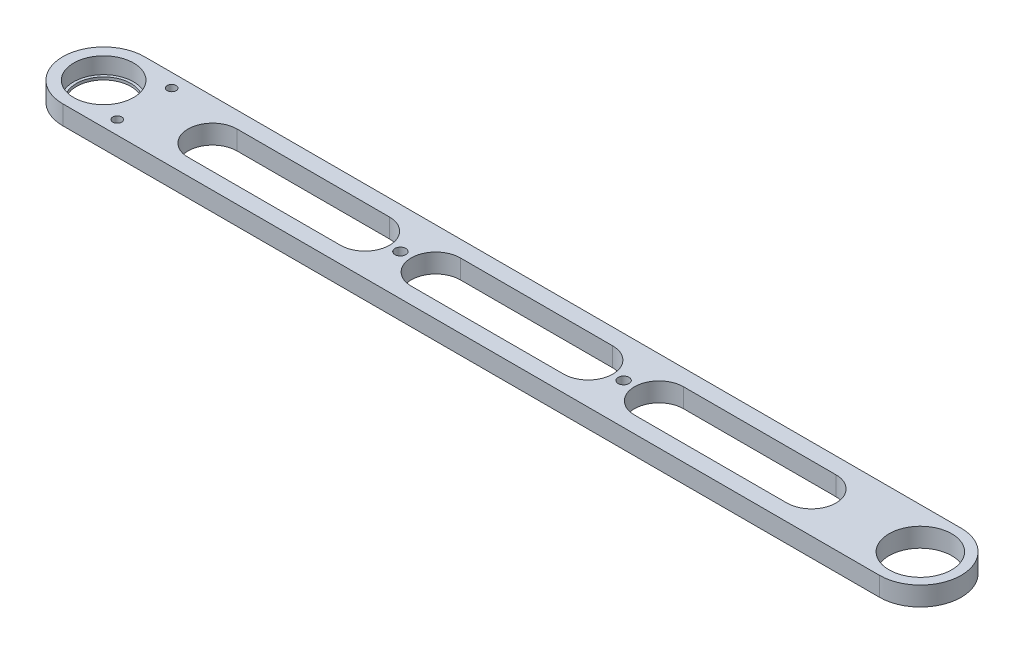
from build123d import *

# Parameters (mm, degrees)
SKETCH1_R             = 11.5
SKETCH1_R_2           = 10
SKETCH1_R_3           = 2
BOSS_EXTRUDE1_DEPTH   = 7
SKETCH2_R             = 11
CUT_EXTRUDE1_DEPTH    = 6
M4_TAPPED_HOLE1_D     = 3.3
M4_TAPPED_HOLE1_DEPTH = 5
M4_TAPPED_HOLE1_TIP   = 0.991420021


with BuildPart() as part:
    # Sketch1 → Boss-Extrude1 (new body)
    with BuildSketch(Plane(origin=(0, 0, 0), x_dir=(1, 0, 0), z_dir=(0, 1, 0))):
        with BuildLine():
            Line((150, -15), (-150, -15))
            ThreePointArc((-150, -15), (-165, 0), (-150, 15))
            Line((-150, 15), (150, 15))
            ThreePointArc((150, 15), (165, 0), (150, -15))
        make_face()
        with Locations(Location((150, 0, 0), (0, 0, 270))):
            Circle(SKETCH1_R, mode=Mode.SUBTRACT)
        with Locations(Location((-150, 0, 0), (0, 0, 270))):
            Circle(SKETCH1_R_2, mode=Mode.SUBTRACT)
        with Locations(Location((40.999999907, 0, 0), (0, 0, 270))):
            Circle(SKETCH1_R_3, mode=Mode.SUBTRACT)
        with Locations(Location((-40.99999998, 0, 0), (0, 0, 270))):
            Circle(SKETCH1_R_3, mode=Mode.SUBTRACT)
        with BuildLine():
            Line((109.999999927, 9), (53.999999907, 9))
            ThreePointArc((53.999999907, 9), (44.999999907, 0), (53.999999907, -9))
            Line((53.999999907, -9), (109.999999927, -9))
            ThreePointArc((109.999999927, -9), (119, 0), (109.999999927, 9))
        make_face(mode=Mode.SUBTRACT)
        with BuildLine():
            Line((27.999999907, 9), (-28.000000112, 9))
            ThreePointArc((-28.000000112, 9), (-36.99999998, 0), (-28.000000112, -9))
            Line((-28.000000112, -9), (27.999999907, -9))
            ThreePointArc((27.999999907, -9), (36.999999907, 0), (27.999999907, 9))
        make_face(mode=Mode.SUBTRACT)
        with BuildLine():
            Line((-53.99999998, 9), (-110, 9))
            ThreePointArc((-110, 9), (-119, 0), (-110, -9))
            Line((-110, -9), (-53.99999998, -9))
            ThreePointArc((-53.99999998, -9), (-44.99999998, 0), (-53.99999998, 9))
        make_face(mode=Mode.SUBTRACT)
    extrude(amount=BOSS_EXTRUDE1_DEPTH)

    # Sketch2 → Cut-Extrude1 (cut)
    with BuildSketch(Plane(origin=(0, 7, 0), x_dir=(1, 0, 0), z_dir=(0, 1, 0))):
        with Locations(Location((-150, 0, 0), (0, 0, 270))):
            Circle(SKETCH2_R)
    extrude(amount=-CUT_EXTRUDE1_DEPTH, mode=Mode.SUBTRACT)

    # M4 Tapped Hole1
    with Locations(Plane(origin=(0, 7, 0), x_dir=(1, 0, 0), z_dir=(0, 1, 0))):
        with Locations((-135, 10), (-135, -10)):
            Hole(M4_TAPPED_HOLE1_D / 2, depth=M4_TAPPED_HOLE1_DEPTH)
            with Locations((0, 0, -(M4_TAPPED_HOLE1_DEPTH + M4_TAPPED_HOLE1_TIP / 2))):  # 118° drill point
                Cone(0, M4_TAPPED_HOLE1_D / 2, M4_TAPPED_HOLE1_TIP, mode=Mode.SUBTRACT)


solid = part.part
